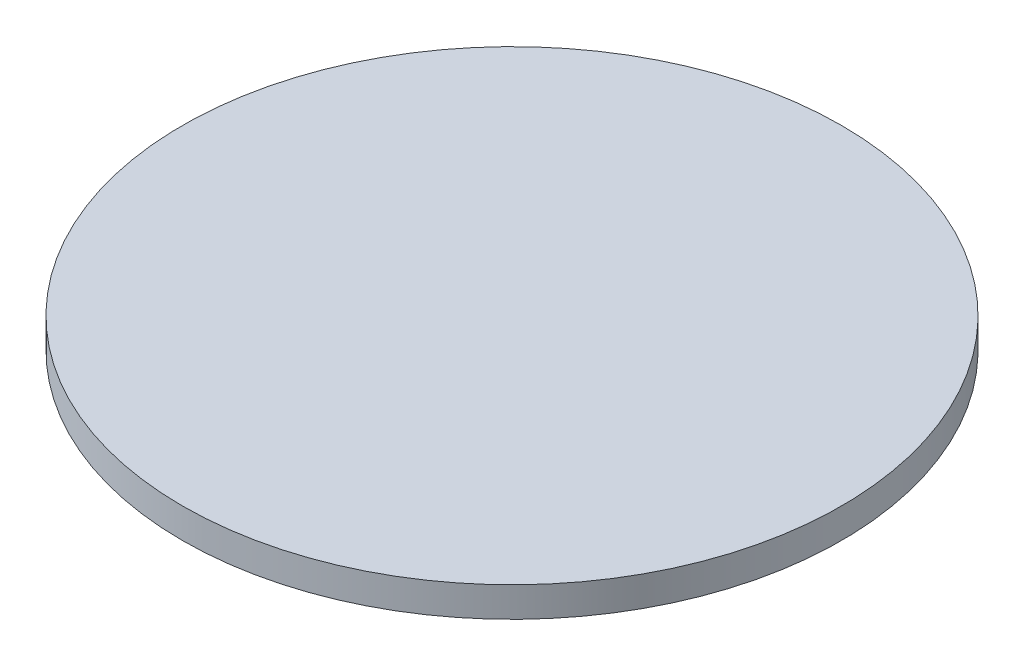
from build123d import *

# Parameters (mm, degrees)
SKETCH1_R           = 33
BOSS_EXTRUDE1_DEPTH = 3


with BuildPart() as part:
    # Sketch1 → Boss-Extrude1 (new body)
    with BuildSketch(Plane(origin=(0, 0, 0), x_dir=(1, 0, 0), z_dir=(0, 1, 0))):
        with Locations(Location((0, 0, 0), (0, 0, 270))):
            Circle(SKETCH1_R)
    extrude(amount=BOSS_EXTRUDE1_DEPTH)


solid = part.part
